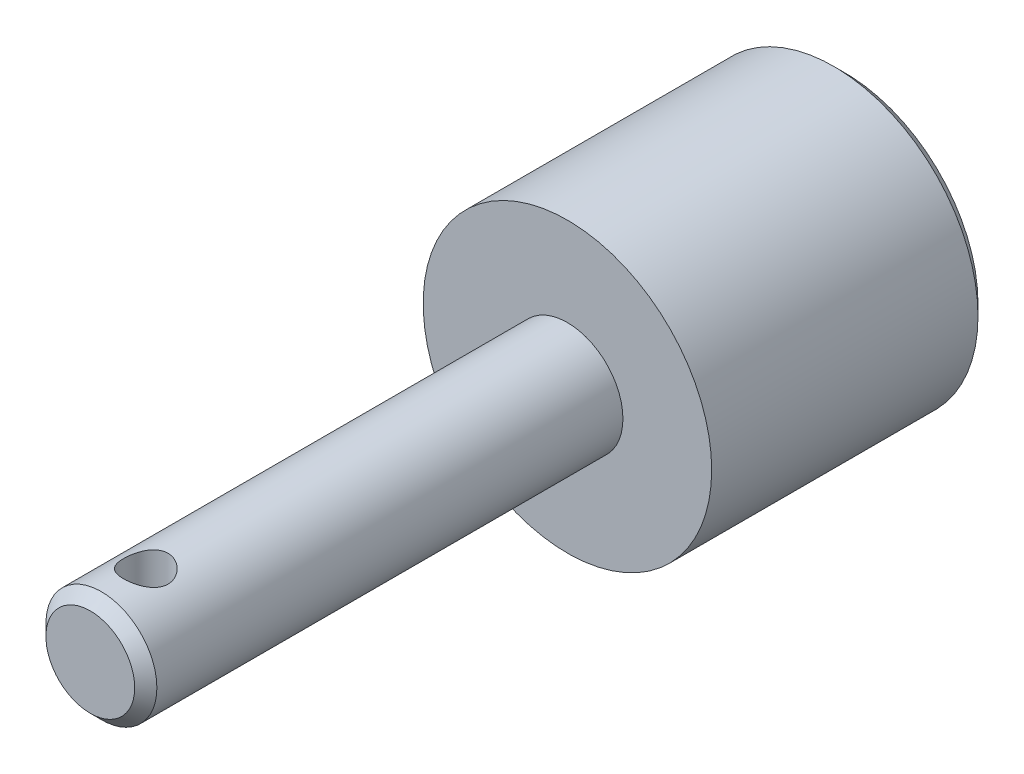
from build123d import *

# Parameters (mm, degrees)
SCHIZZO1_R             = 26
ESTRUSIONE1_DEPTH      = 50
SCHIZZO2_R             = 10
ESTRUSIONE2_DEPTH      = 86
SMUSSO1_SIZE           = 2
ESTRUSIONE3_DEPTH      = 141.882930123
ESTRUSIONE3_DEPTH_BACK = 141.882930123
SCHIZZO3_R             = 4
SMUSSO2_SIZE           = 2


with BuildPart() as part:
    # Schizzo1 → Estrusione1 (new body)
    with BuildSketch(Plane.XY):
        Circle(SCHIZZO1_R)
    extrude(amount=ESTRUSIONE1_DEPTH)

    # Schizzo2 → Estrusione2 (add)
    with BuildSketch(Plane.XY.offset(50)):
        Circle(SCHIZZO2_R)
    extrude(amount=ESTRUSIONE2_DEPTH)

    # Smusso1
    smusso1_edges = [part.edges().sort_by_distance(p)[0] for p in [
        (-10, 0, 136),
    ]]
    chamfer(smusso1_edges, length=SMUSSO1_SIZE)

    # Schizzo3 → Estrusione3 (cut, two sides: drawn at the far end of the back side and taken through both)
    with BuildSketch(Plane(origin=(0, 0, 0), x_dir=(1, 0, 0), z_dir=(0, 1, 0)).offset(-ESTRUSIONE3_DEPTH_BACK)):
        with Locations(Location((0, -126, 0), (0, 0, 270))):
            Circle(SCHIZZO3_R)
    extrude(amount=ESTRUSIONE3_DEPTH + ESTRUSIONE3_DEPTH_BACK, mode=Mode.SUBTRACT)

    # Smusso2
    smusso2_edges = [part.edges().sort_by_distance(p)[0] for p in [
        (-26, 0, 0),
    ]]
    chamfer(smusso2_edges, length=SMUSSO2_SIZE)


solid = part.part
